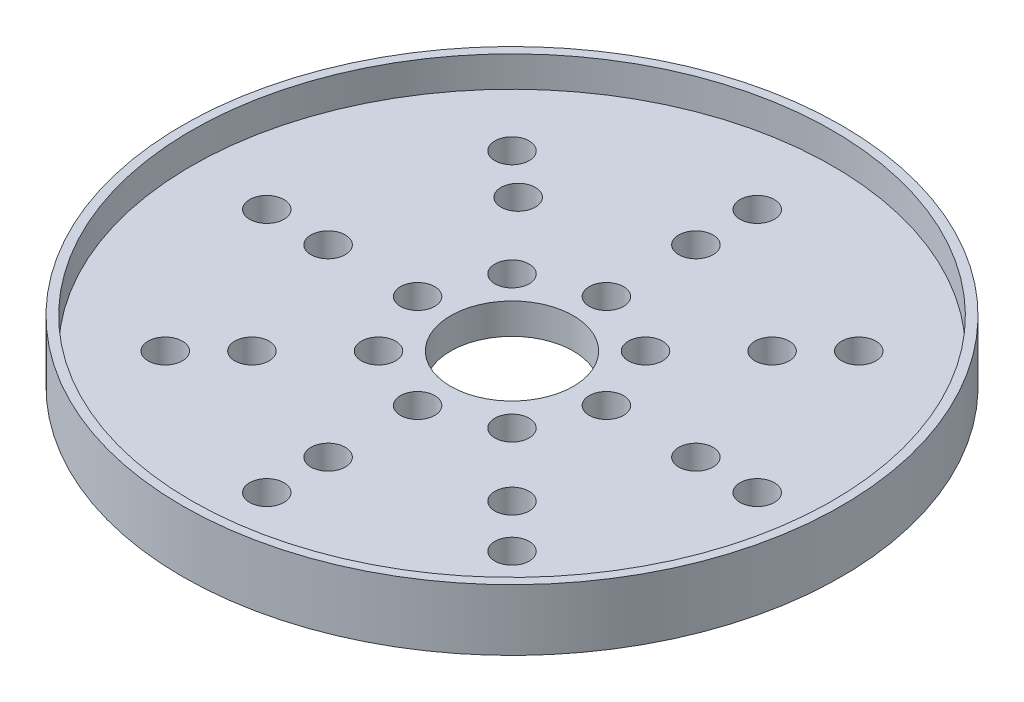
from build123d import *

# Parameters (mm, degrees)
SKETCH1_R           = 34.1376
BOSS_EXTRUDE1_DEPTH = 6.35
SKETCH2_R           = 33.2105
CUT_EXTRUDE3_DEPTH  = 3.175
SKETCH3_R           = 6.35
CUT_EXTRUDE4_DEPTH  = 3.175
SKETCH3_3_R         = 6.35
SKETCH3_3_R_2       = 1.778
CUT_EXTRUDE5_DEPTH  = 3.175
SKETCH6_R           = 1.778
CUT_EXTRUDE6_DEPTH  = 3.175
SKETCH8_R           = 1.778
CUT_EXTRUDE7_DEPTH  = 3.175


with BuildPart() as part:
    # Sketch1 → Boss-Extrude1 (new body)
    with BuildSketch(Plane(origin=(0, 0, 0), x_dir=(1, 0, 0), z_dir=(0, 1, 0))):
        Circle(SKETCH1_R)
    extrude(amount=BOSS_EXTRUDE1_DEPTH)

    # Sketch2 → Cut-Extrude3 (cut)
    with BuildSketch(Plane(origin=(0, 6.35, 0), x_dir=(1, 0, 0), z_dir=(0, 1, 0))):
        Circle(SKETCH2_R)
    extrude(amount=-CUT_EXTRUDE3_DEPTH, mode=Mode.SUBTRACT)

    # Sketch3 → Cut-Extrude4 (cut)
    with BuildSketch(Plane(origin=(0, 3.175, 0), x_dir=(1, 0, 0), z_dir=(0, 1, 0))):
        Circle(SKETCH3_R)
    extrude(amount=-CUT_EXTRUDE4_DEPTH, mode=Mode.SUBTRACT)

    # Sketch3<3> → Cut-Extrude5 (cut)
    with BuildSketch(Plane(origin=(0, 3.175, 0), x_dir=(1, 0, 0), z_dir=(0, 1, 0))):
        Circle(SKETCH3_3_R)
        with Locations((25.4, 0)):
            Circle(SKETCH3_3_R_2)
        with Locations((17.960512242, 17.960512242)):
            Circle(SKETCH3_3_R_2)
        with Locations((0, 25.4)):
            Circle(SKETCH3_3_R_2)
        with Locations((-17.960512242, 17.960512242)):
            Circle(SKETCH3_3_R_2)
        with Locations((-25.4, 0)):
            Circle(SKETCH3_3_R_2)
        with Locations((-17.960512242, -17.960512242)):
            Circle(SKETCH3_3_R_2)
        with Locations((0, -25.4)):
            Circle(SKETCH3_3_R_2)
        with Locations((17.960512242, -17.960512242)):
            Circle(SKETCH3_3_R_2)
    extrude(amount=-CUT_EXTRUDE5_DEPTH, mode=Mode.SUBTRACT)

    # Sketch6 → Cut-Extrude6 (cut)
    with BuildSketch(Plane(origin=(0, 3.175, 0), x_dir=(1, 0, 0), z_dir=(0, 1, 0))):
        with Locations((0, 19.05)):
            Circle(SKETCH6_R)
        with Locations((-13.470384182, 14.10896611)):
            Circle(SKETCH6_R)
        with Locations((-19.05, 0)):
            Circle(SKETCH6_R)
        with Locations((-13.470384182, -13.470384182)):
            Circle(SKETCH6_R)
        with Locations((0, -19.05)):
            Circle(SKETCH6_R)
        with Locations((13.470384182, -13.470384182)):
            Circle(SKETCH6_R)
        with Locations((19.05, 0)):
            Circle(SKETCH6_R)
        with Locations((13.470384182, 13.470384182)):
            Circle(SKETCH6_R)
    extrude(amount=-CUT_EXTRUDE6_DEPTH, mode=Mode.SUBTRACT)

    # Sketch8 → Cut-Extrude7 (cut)
    with BuildSketch(Plane(origin=(0, 3.175, 0), x_dir=(1, 0, 0), z_dir=(0, 1, 0))):
        with Locations((9.779, 0)):
            Circle(SKETCH8_R)
        with Locations((6.914797213, 6.914797213)):
            Circle(SKETCH8_R)
        with Locations((0, 9.779)):
            Circle(SKETCH8_R)
        with Locations((-6.914797213, 6.914797213)):
            Circle(SKETCH8_R)
        with Locations((-9.779, 0)):
            Circle(SKETCH8_R)
        with Locations((-6.914797213, -6.914797213)):
            Circle(SKETCH8_R)
        with Locations((0, -9.779)):
            Circle(SKETCH8_R)
        with Locations((6.914797213, -6.914797213)):
            Circle(SKETCH8_R)
    extrude(amount=-CUT_EXTRUDE7_DEPTH, mode=Mode.SUBTRACT)


solid = part.part
